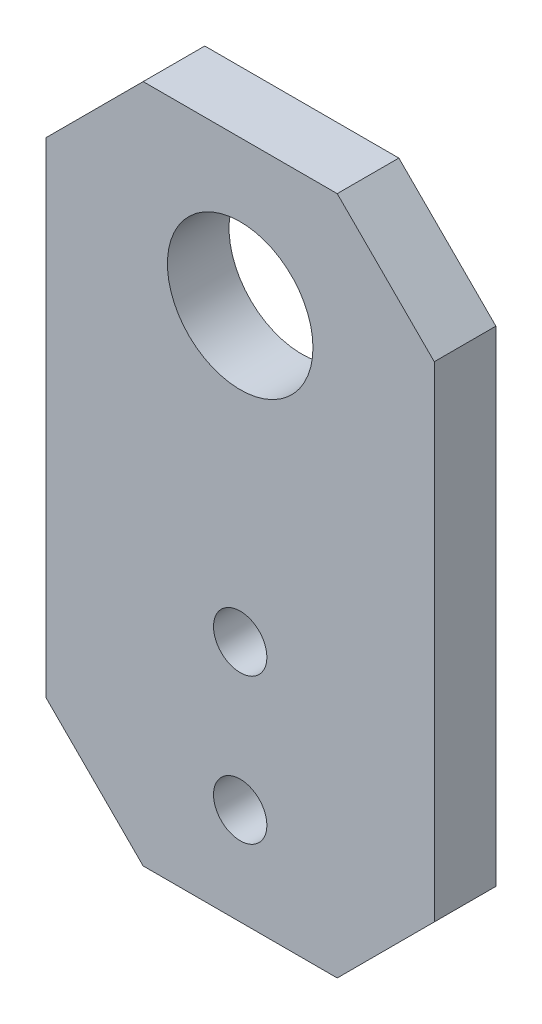
from build123d import *

# Parameters (mm, degrees)
SKETCH1_W            = 40
SKETCH1_H            = 70
SKETCH1_R            = 7.5
BOSS_EXTRUDE1_DEPTH  = 6.35
M5_CLEARANCE_HOLE1_D = 5.5
CHAMFER1_SIZE        = 10


with BuildPart() as part:
    # Sketch1 → Boss-Extrude1 (new body)
    with BuildSketch(Plane.XY):
        Rectangle(SKETCH1_W, SKETCH1_H)
        with Locations((0, 20)):
            Circle(SKETCH1_R, mode=Mode.SUBTRACT)
    extrude(amount=BOSS_EXTRUDE1_DEPTH)

    # M5 Clearance Hole1 (through all)
    with Locations(Plane.XY.offset(6.35)):
        with Locations((0, -10), (0, -25)):
            Hole(M5_CLEARANCE_HOLE1_D / 2)

    # Chamfer1
    chamfer1_edges = [part.edges().sort_by_distance(p)[0] for p in [
        (-20, 35, 3.175),
        (20, 35, 3.175),
        (20, -35, 3.175),
        (-20, -35, 3.175),
    ]]
    chamfer(chamfer1_edges, length=CHAMFER1_SIZE)


solid = part.part
